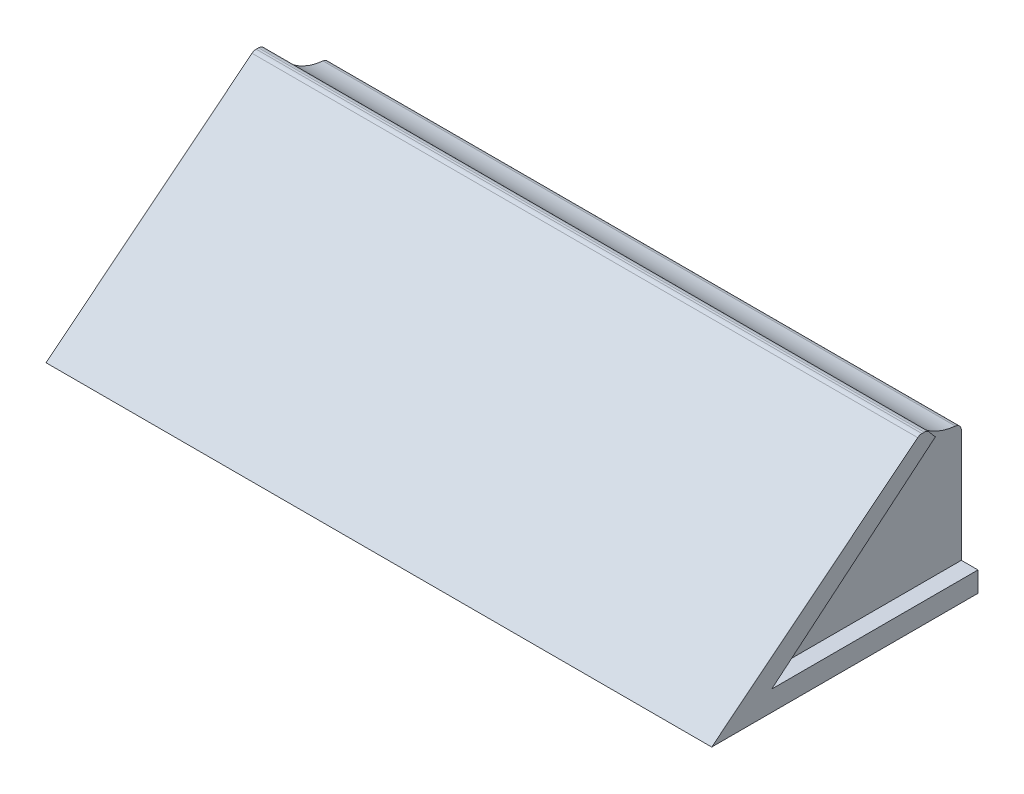
from build123d import *

# Parameters (mm, degrees)
SKETCH1_W               = 100
SKETCH1_H               = 25
BOSS_EXTRUDE1_DEPTH     = 40
CUT_EXTRUDE2_DEPTH      = 111.566721937
CUT_EXTRUDE2_DEPTH_BACK = 111.566721937
CUT_EXTRUDE3_DEPTH      = 111.566721937
CUT_EXTRUDE3_DEPTH_BACK = 111.566721937
FILLET1_R               = 1
FILLET2_R               = 1
FILLET3_R               = 1
CUT_EXTRUDE5_DEPTH      = 111.566721937
CUT_EXTRUDE5_DEPTH_BACK = 2.5
CUT_EXTRUDE6_DEPTH      = 111.566721937
CUT_EXTRUDE6_DEPTH_BACK = 2.5


with BuildPart() as part:
    # Sketch1 → Boss-Extrude1 (new body)
    with BuildSketch(Plane.XY):
        with Locations((-50, 12.5)):
            Rectangle(SKETCH1_W, SKETCH1_H)
    extrude(amount=BOSS_EXTRUDE1_DEPTH)

    # Sketch2 → Cut-Extrude2 (cut, two sides: drawn at the far end of the back side and taken through both)
    with BuildSketch(Plane(origin=(0, 0, 0), x_dir=(0, 0, -1), z_dir=(1, 0, 0)).offset(-CUT_EXTRUDE2_DEPTH_BACK)):
        Polygon((-121.448428088, -65.214643972), (-40, 0), (-8.776787265, 25), (72.671640823, 90.214643972), (-57.757647122, 253.111500148), (-251.877716033, 97.682212203), align=None)
    extrude(amount=CUT_EXTRUDE2_DEPTH + CUT_EXTRUDE2_DEPTH_BACK, mode=Mode.SUBTRACT)

    # Sketch3 → Cut-Extrude3 (cut, two sides: drawn at the far end of the back side and taken through both)
    with BuildSketch(Plane(origin=(0, 0, 0), x_dir=(0, 0, -1), z_dir=(1, 0, 0)).offset(-CUT_EXTRUDE3_DEPTH_BACK)):
        with BuildLine():
            Line((-62.314729864, 108.995582426), (-7.550030072, 25))
            ThreePointArc((-7.550030072, 25), (-4.293432475, 21.998146007), (0, 20.910491242))
            Line((0, 20.910491242), (100.271779857, 20.929846374))
            Line((100.271779857, 20.929846374), (195.785658883, 197.26707941))
            Line((195.785658883, 197.26707941), (33.199149162, 285.332815462))
            Line((33.199149162, 285.332815462), (-62.314729864, 108.995582426))
        make_face()
    extrude(amount=CUT_EXTRUDE3_DEPTH + CUT_EXTRUDE3_DEPTH_BACK, mode=Mode.SUBTRACT)

    # Fillet1
    fillet1_edges = [part.edges().sort_by_distance(p)[0] for p in [
        (-50, 25, 8.776787265),
    ]]
    fillet(fillet1_edges, radius=FILLET1_R)

    # Fillet2
    fillet2_edges = [part.edges().sort_by_distance(p)[0] for p in [
        (-50, 25, 7.550030072),
    ]]
    fillet(fillet2_edges, radius=FILLET2_R)

    # Fillet3
    fillet3_edges = [part.edges().sort_by_distance(p)[0] for p in [
        (-50, 20.910491242, 0),
    ]]
    fillet(fillet3_edges, radius=FILLET3_R)

    # Sketch4 → Cut-Extrude5 (cut, two sides: drawn at the far end of the back side and taken through both)
    with BuildSketch(Plane(origin=(0, 0, 0), x_dir=(0, 0, -1), z_dir=(1, 0, 0)).offset(-CUT_EXTRUDE5_DEPTH_BACK)):
        Polygon((101.259117222, 3.044212175), (0, 3.044212175), (-30.990460295, 3.044212175), (-6.392305733, 23.56865294), (71.356704641, 88.441607291), (262.495931804, 155.370159656), (292.398344384, 69.97276454), align=None)
    extrude(amount=CUT_EXTRUDE5_DEPTH + CUT_EXTRUDE5_DEPTH_BACK, mode=Mode.SUBTRACT)

    # Sketch5 → Cut-Extrude6 (cut, two sides: drawn at the far end of the back side and taken through both)
    with BuildSketch(Plane.ZY.offset(100).offset(-CUT_EXTRUDE6_DEPTH_BACK)):
        Polygon((-101.259117222, 3.044212175), (0, 3.044212175), (30.8250701, 3.044212175), (6.37948349, 23.555780442), (-71.190616863, 88.642555993), (-262.263101068, 155.761413714), (-292.331601426, 70.163069896), align=None)
    extrude(amount=CUT_EXTRUDE6_DEPTH + CUT_EXTRUDE6_DEPTH_BACK, mode=Mode.SUBTRACT)


solid = part.part
